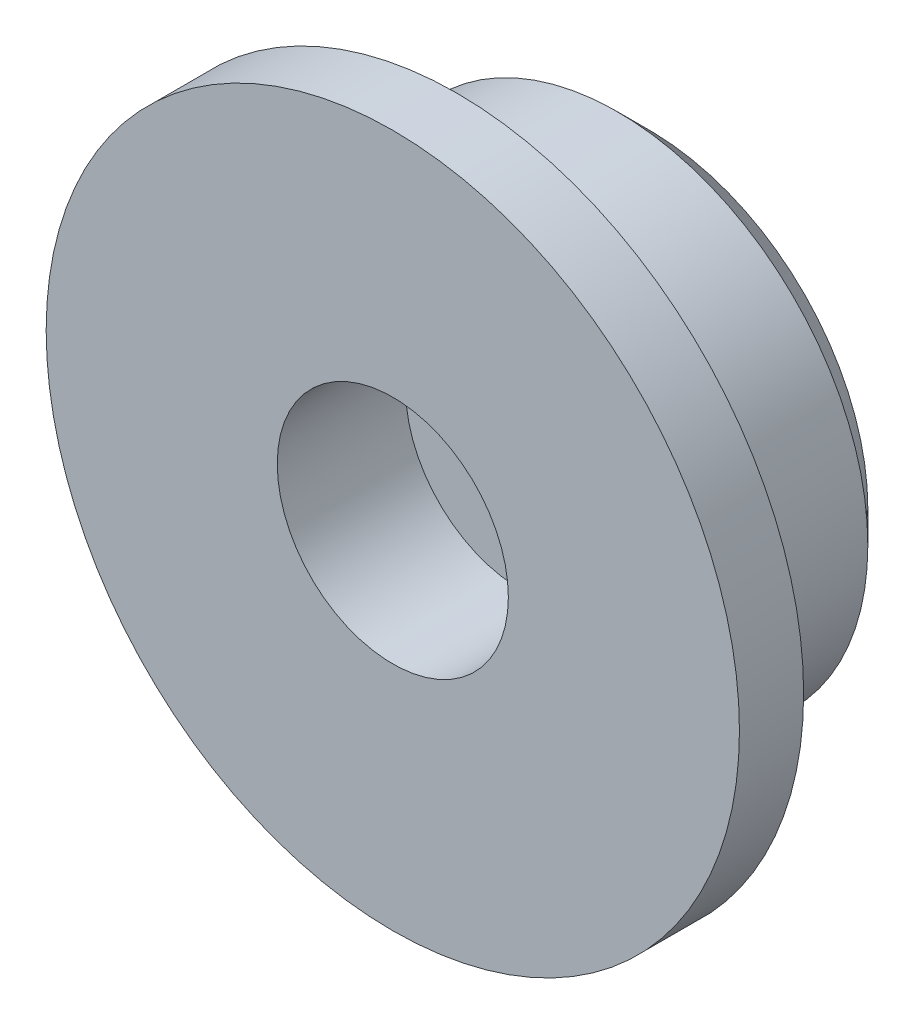
from build123d import *

# Parameters (mm, degrees)
SKETCH_1_R          = 3.9
EXTRUDE_1_DEPTH     = 3
CHAMFER_1_SIZE      = 0.5
SKETCH_4_R          = 5.4
EXTRUDE_2_DEPTH     = 1
SKETCH_5_R          = 1.8
CUT_EXTRUDE_2_DEPTH = 2


with BuildPart() as part:
    # Эскиз1 → Бобышка-Вытянуть1 (new body)
    with BuildSketch(Plane.XY):
        Circle(SKETCH_1_R)
    extrude(amount=EXTRUDE_1_DEPTH)

    # Фаска1
    chamfer_1_edges = [part.edges().sort_by_distance(p)[0] for p in [
        (-3.9, 0, 0),
    ]]
    chamfer(chamfer_1_edges, length=CHAMFER_1_SIZE)

    # Эскиз4 → Бобышка-Вытянуть2 (add)
    with BuildSketch(Plane.XY.offset(3)):
        Circle(SKETCH_4_R)
    extrude(amount=EXTRUDE_2_DEPTH)

    # Эскиз5 → Вырез-Вытянуть2 (cut)
    with BuildSketch(Plane.XY.offset(4)):
        Circle(SKETCH_5_R)
    extrude(amount=-CUT_EXTRUDE_2_DEPTH, mode=Mode.SUBTRACT)


solid = part.part
